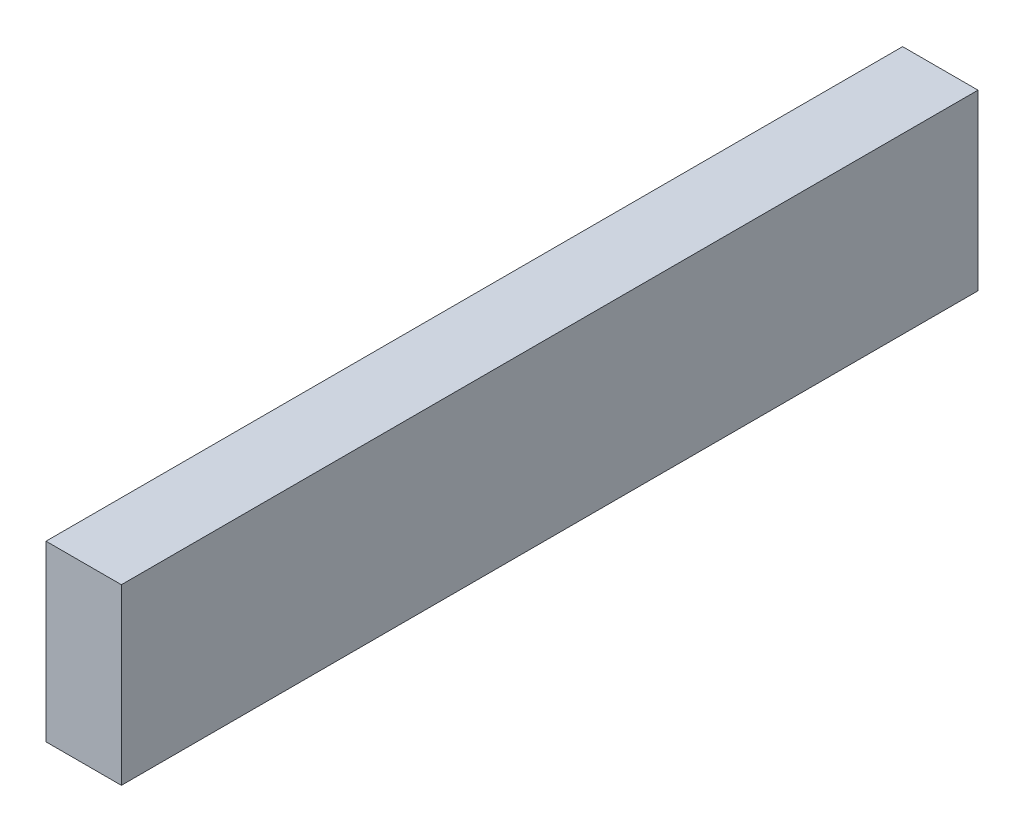
from build123d import *

# Parameters (mm, degrees)
SKETCH1_W           = 87.6
SKETCH1_H           = 38
BOSS_EXTRUDE1_DEPTH = 431.8


with BuildPart() as part:
    # Sketch1 → Boss-Extrude1 (new body)
    with BuildSketch(Plane(origin=(0, 0, 0), x_dir=(0, 1, 0), z_dir=(0, 0, 1))):
        with Locations((43.8, 19)):
            Rectangle(SKETCH1_W, SKETCH1_H)
    extrude(amount=BOSS_EXTRUDE1_DEPTH)


solid = part.part
